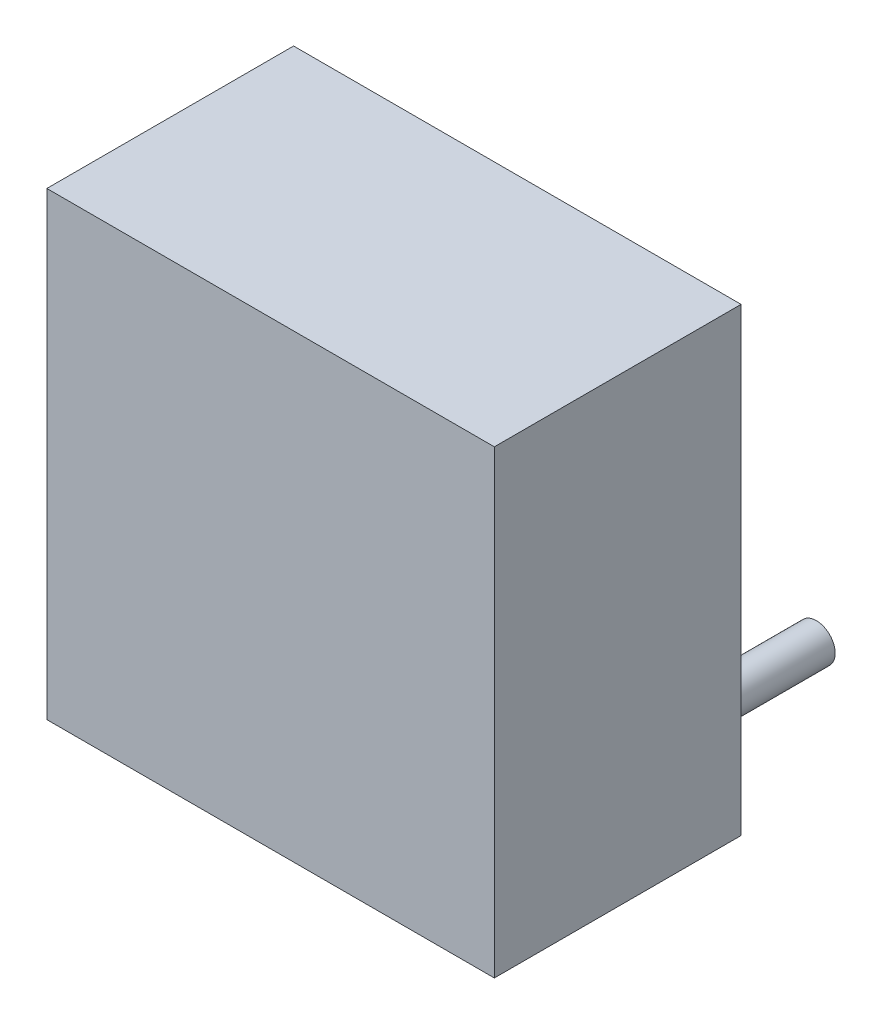
from build123d import *

# Parameters (mm, degrees)
SKETCH1_W           = 10.7
SKETCH1_H           = 11
BOSS_EXTRUDE1_DEPTH = 5.9
SKETCH2_R           = 0.45
BOSS_EXTRUDE2_DEPTH = 3.4


with BuildPart() as part:
    # Sketch1 → Boss-Extrude1 (new body)
    with BuildSketch(Plane.XY):
        Rectangle(SKETCH1_W, SKETCH1_H)
    extrude(amount=BOSS_EXTRUDE1_DEPTH)

    # Sketch2 → Boss-Extrude2 (add)
    with BuildSketch(Plane(origin=(0, 0, 0), x_dir=(-1, 0, 0), z_dir=(0, 0, -1))):
        with Locations((-3.75, -4)):
            Circle(SKETCH2_R)
        with Locations((-1.25, -4)):
            Circle(SKETCH2_R)
        with Locations((1.25, -4)):
            Circle(SKETCH2_R)
        with Locations((3.75, -4)):
            Circle(SKETCH2_R)
    extrude(amount=BOSS_EXTRUDE2_DEPTH)


solid = part.part
